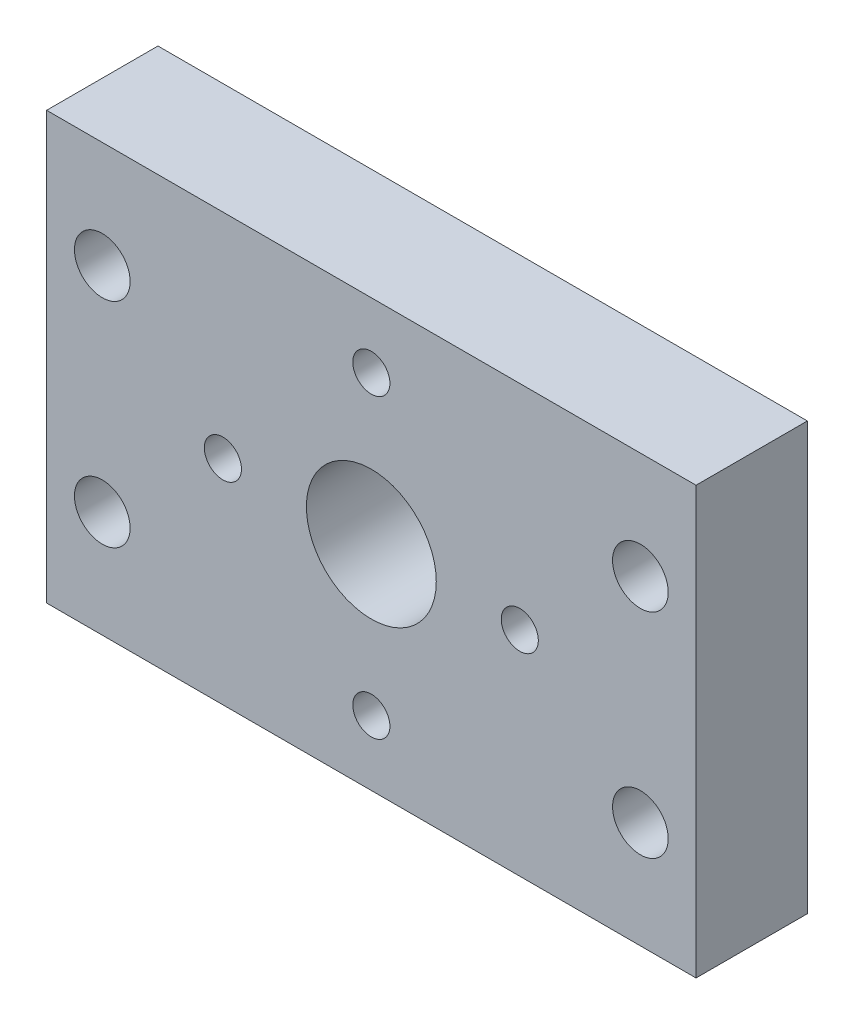
from build123d import *

# Parameters (mm, degrees)
ESQUISSE1_W        = 35
ESQUISSE1_H        = 23
ESQUISSE1_R        = 3.5
ESQUISSE1_R_2      = 1
ESQUISSE1_R_3      = 1.5
BOSS_EXTRU_1_DEPTH = 6


with BuildPart() as part:
    # Esquisse1 → Boss.-Extru.1 (new body)
    with BuildSketch(Plane.XY):
        Rectangle(ESQUISSE1_W, ESQUISSE1_H)
        Circle(ESQUISSE1_R, mode=Mode.SUBTRACT)
        with Locations((0, 8)):
            Circle(ESQUISSE1_R_2, mode=Mode.SUBTRACT)
        with Locations((8, 0)):
            Circle(ESQUISSE1_R_2, mode=Mode.SUBTRACT)
        with Locations((0, -8)):
            Circle(ESQUISSE1_R_2, mode=Mode.SUBTRACT)
        with Locations((-8, 0)):
            Circle(ESQUISSE1_R_2, mode=Mode.SUBTRACT)
        with Locations((-14.5, 5.75)):
            Circle(ESQUISSE1_R_3, mode=Mode.SUBTRACT)
        with Locations(Location((-14.5, -5.75, 0), (0, 0, 180))):
            Circle(ESQUISSE1_R_3, mode=Mode.SUBTRACT)
        with Locations((14.5, -5.75)):
            Circle(ESQUISSE1_R_3, mode=Mode.SUBTRACT)
        with Locations(Location((14.5, 5.75, 0), (0, 0, 180))):
            Circle(ESQUISSE1_R_3, mode=Mode.SUBTRACT)
    extrude(amount=BOSS_EXTRU_1_DEPTH)


solid = part.part
